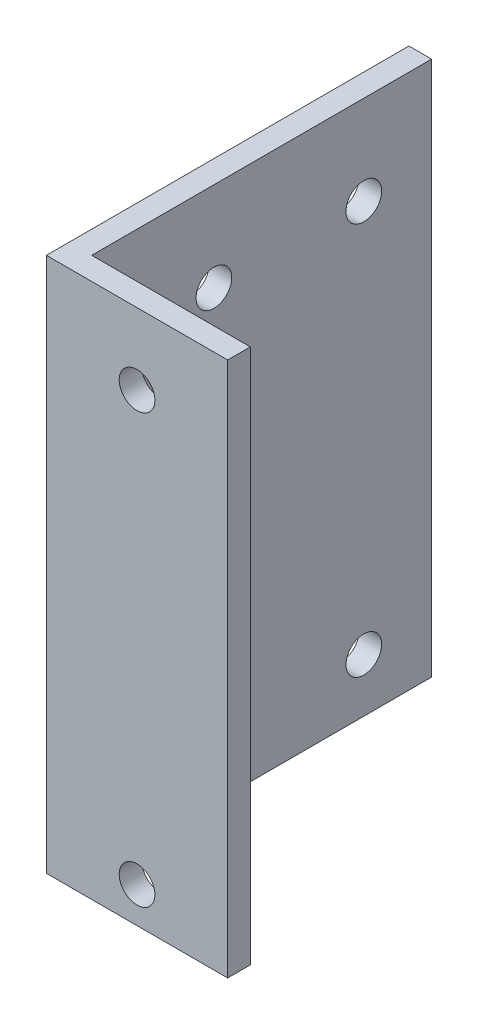
from build123d import *

# Parameters (mm, degrees)
SALIENTE_EXTRUIR1_DEPTH = 80
CROQUIS2_R              = 2.5
CORTAR_EXTRUIR1_DEPTH   = 99.111161445
CROQUIS3_R              = 2.5
CORTAR_EXTRUIR2_DEPTH   = 99.111161445
CROQUIS4_W              = 30
CROQUIS4_H              = 10
CORTAR_EXTRUIR3_DEPTH   = 99.111161445


with BuildPart() as part:
    # Croquis1 → Saliente-Extruir1 (new body)
    with BuildSketch(Plane(origin=(0, 0, 0), x_dir=(1, 0, 0), z_dir=(0, 1, 0))):
        Polygon((25.4, 0), (0, 0), (0, 50.8), (3.175, 50.8), (3.175, 3.175), (25.4, 3.175), align=None)
    extrude(amount=SALIENTE_EXTRUIR1_DEPTH)

    # Croquis2 → Cortar-Extruir1 (cut, through all)
    with BuildSketch(Plane.ZY):
        with Locations((-41.3, 67.5)):
            Circle(CROQUIS2_R)
        with Locations((-20.3, 67.5)):
            Circle(CROQUIS2_R)
        with Locations((-20.3, 12.5)):
            Circle(CROQUIS2_R)
        with Locations((-41.3, 12.5)):
            Circle(CROQUIS2_R)
    extrude(amount=-CORTAR_EXTRUIR1_DEPTH, mode=Mode.SUBTRACT)

    # Croquis3 → Cortar-Extruir2 (cut, through all)
    with BuildSketch(Plane.XY):
        with Locations((12.7, 70)):
            Circle(CROQUIS3_R)
        with Locations((12.7, 10)):
            Circle(CROQUIS3_R)
    extrude(amount=-CORTAR_EXTRUIR2_DEPTH, mode=Mode.SUBTRACT)

    # Croquis4 → Cortar-Extruir3 (cut, through all)
    with BuildSketch(Plane.XY):
        with Locations((12.7, 0)):
            Rectangle(CROQUIS4_W, CROQUIS4_H)
    extrude(amount=-CORTAR_EXTRUIR3_DEPTH, mode=Mode.SUBTRACT)


solid = part.part
